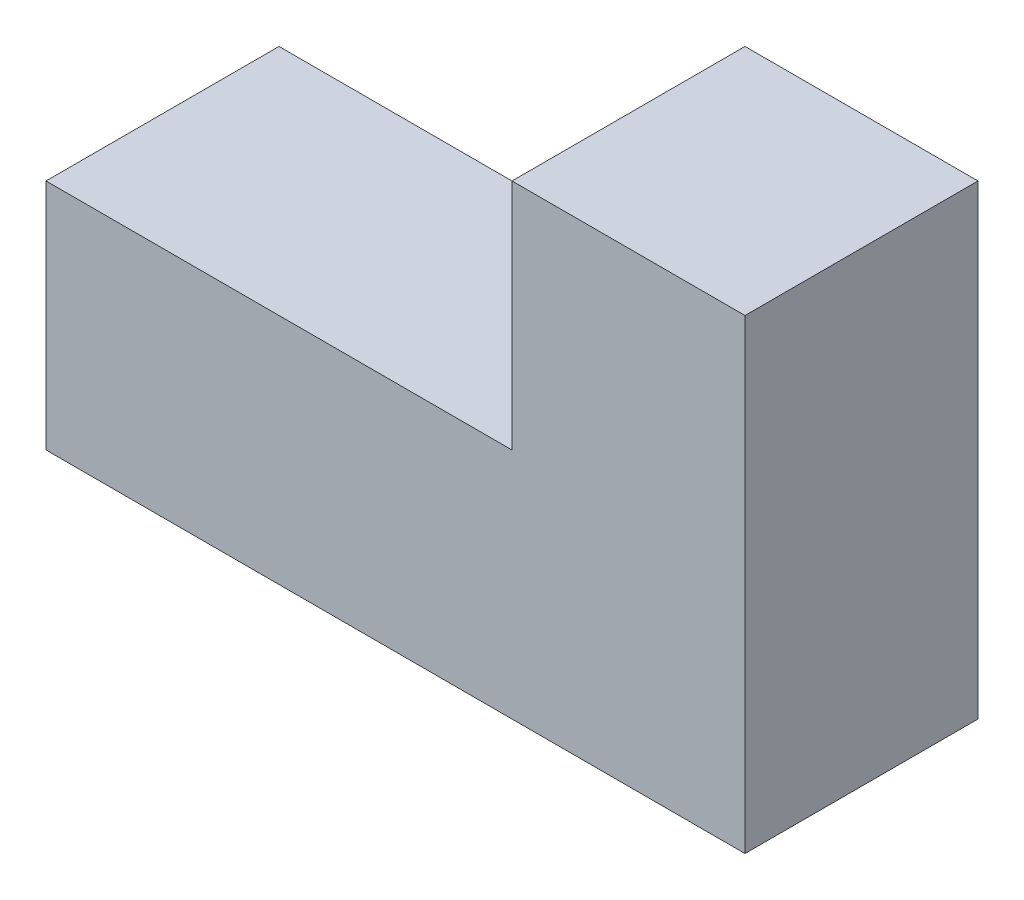
from build123d import *

# Parameters (mm, degrees)
EXTRUDE_1_DEPTH      = 15
EXTRUDE_1_DEPTH_BACK = 15


with BuildPart() as part:
    # 草圖1 → 擠出1 (new, two sides: drawn at the far end of the back side and taken through both)
    with BuildSketch(Plane.XY.offset(-EXTRUDE_1_DEPTH_BACK)):
        Polygon((0, 0), (90, 0), (90, 60), (60, 60), (60, 30), (0, 30), align=None)
    extrude(amount=EXTRUDE_1_DEPTH + EXTRUDE_1_DEPTH_BACK)


solid = part.part
